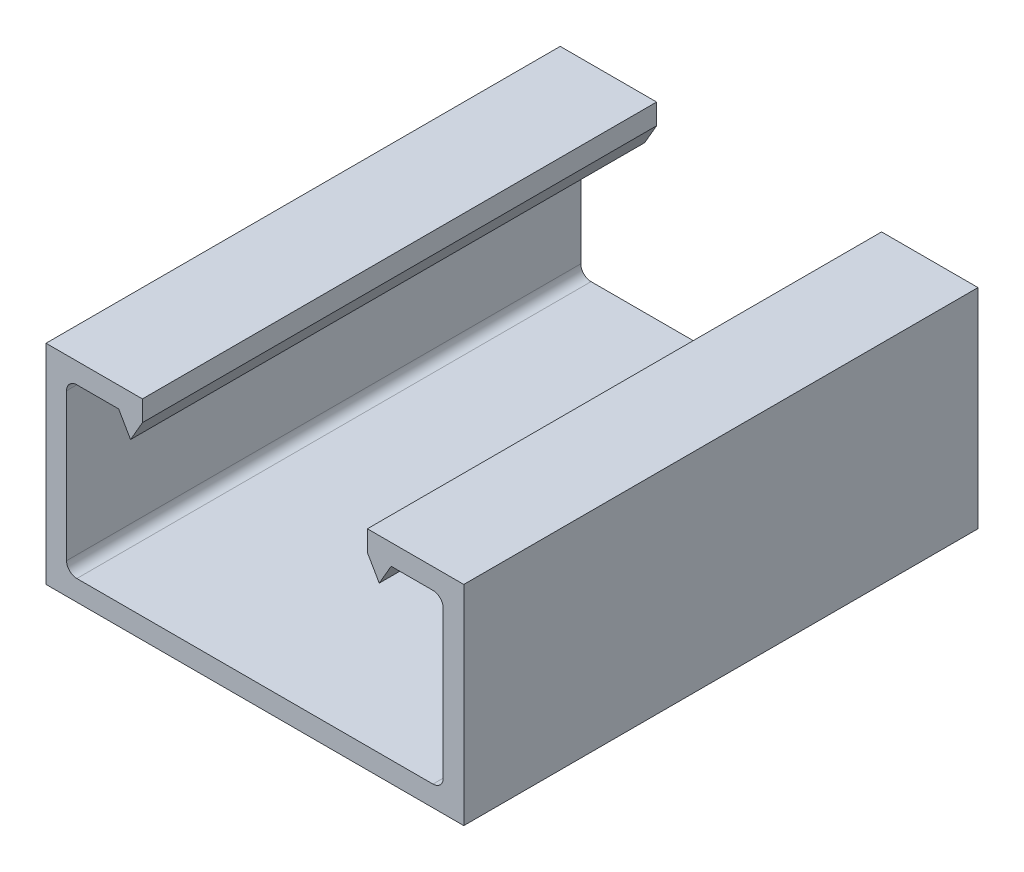
from build123d import *

# Parameters (mm, degrees)
BASE_EXTRUDE_DEPTH = 12.7


with BuildPart() as part:
    # Sketch1 → Base-Extrude (new, symmetric)
    with BuildSketch(Plane.XY):
        with BuildLine():
            Line((-5.55625, 5.159375), (-10.31875, 5.159375))
            Line((-10.31875, 5.159375), (-10.31875, -5.159375))
            Line((-10.31875, -5.159375), (10.31875, -5.159375))
            Line((10.31875, -5.159375), (10.31875, 5.159375))
            Line((10.31875, 5.159375), (5.55625, 5.159375))
            Line((5.55625, 5.159375), (5.55625, 4.143375))
            Line((5.55625, 4.143375), (6.142837874, 3.127375))
            Line((6.142837874, 3.127375), (6.729425747, 4.143375))
            Line((6.729425747, 4.143375), (8.79475, 4.143375))
            ThreePointArc((8.79475, 4.143375), (9.153960245, 3.994585245), (9.30275, 3.635375))
            Line((9.30275, 3.635375), (9.30275, -3.635375))
            ThreePointArc((9.30275, -3.635375), (9.153960245, -3.994585245), (8.79475, -4.143375))
            Line((8.79475, -4.143375), (-8.79475, -4.143375))
            ThreePointArc((-8.79475, -4.143375), (-9.153960245, -3.994585245), (-9.30275, -3.635375))
            Line((-9.30275, -3.635375), (-9.30275, 3.635375))
            ThreePointArc((-9.30275, 3.635375), (-9.153960245, 3.994585245), (-8.79475, 4.143375))
            Line((-8.79475, 4.143375), (-6.729425747, 4.143375))
            Line((-6.729425747, 4.143375), (-6.142837874, 3.127375))
            Line((-6.142837874, 3.127375), (-5.55625, 4.143375))
            Line((-5.55625, 4.143375), (-5.55625, 5.159375))
        make_face()
    extrude(amount=BASE_EXTRUDE_DEPTH, both=True)


solid = part.part
